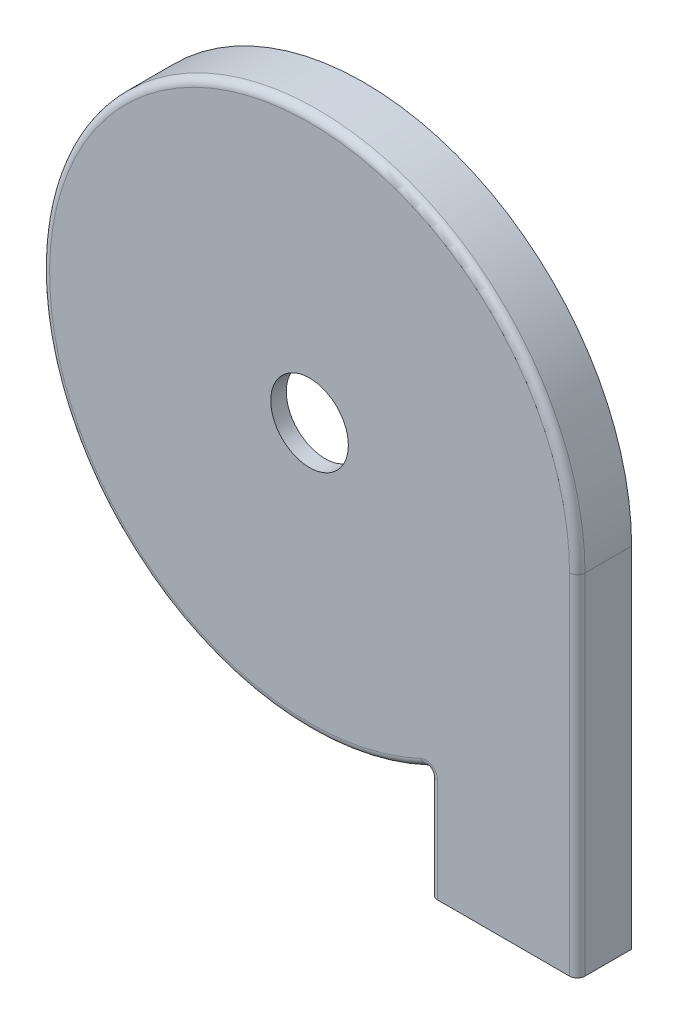
from build123d import *

# Parameters (mm, degrees)
BOSS_EXTRU_1_DEPTH      = 2
BOSS_EXTRU_2_START      = -7
BOSS_EXTRU_2_DEPTH      = 5
BOSS_EXTRU_3_START      = -1
BOSS_EXTRU_3_DEPTH      = 1
CONG_1_R                = 0.25
BOSS_EXTRU_4_DEPTH      = 2
CONG_4_R                = 1
ESQUISSE5_R             = 5
ENL_V_MAT_EXTRU_1_DEPTH = 55.929567647
ESQUISSE6_W             = 15
ESQUISSE6_H             = 5
ENL_V_MAT_EXTRU_2_DEPTH = 2
ENL_V_MAT_EXTRU_3_DEPTH = 2


with BuildPart() as part:
    # Esquisse1 → Boss.-Extru.1 (new body)
    with BuildSketch(Plane.XY):
        with BuildLine():
            Line((31.551874669, -39.37254902), (31.551874669, 5.62745098))
            ThreePointArc((31.551874669, 5.62745098), (-28.41563861, 22.999431705), (12.980446097, -23.736555864))
            ThreePointArc((12.980446097, -23.736555864), (15.388180878, -23.882439984), (16.551874669, -25.995325621))
            Line((16.551874669, -25.995325621), (16.551874669, -39.37254902))
            Line((16.551874669, -39.37254902), (31.551874669, -39.37254902))
        make_face()
    extrude(amount=BOSS_EXTRU_1_DEPTH)



with BuildPart() as body_2:
    # Esquisse2 → Boss.-Extru.2 (new body)
    with BuildSketch(Plane.XY.offset(2).offset(BOSS_EXTRU_2_START)):
        with BuildLine():
            Line((14.551874669, -41.37254902), (33.551874669, -41.37254902))
            Line((33.551874669, -41.37254902), (33.551874669, 5.62745098))
            ThreePointArc((33.551874669, 5.62745098), (-30.105947119, 24.068476672), (13.837588955, -25.54357167))
            ThreePointArc((13.837588955, -25.54357167), (14.319135911, -25.572748494), (14.551874669, -25.995325621))
            Line((14.551874669, -25.995325621), (14.551874669, -41.37254902))
        make_face()
        with BuildLine():
            Line((16.551874669, -39.37254902), (31.551874669, -39.37254902))
            Line((31.551874669, -39.37254902), (31.551874669, 5.62745098))
            ThreePointArc((31.551874669, 5.62745098), (-28.41563861, 22.999431705), (12.980446097, -23.736555864))
            ThreePointArc((12.980446097, -23.736555864), (15.388180878, -23.882439984), (16.551874669, -25.995325621))
            Line((16.551874669, -25.995325621), (16.551874669, -39.37254902))
        make_face(mode=Mode.SUBTRACT)
    extrude(amount=BOSS_EXTRU_2_DEPTH)

    # Esquisse3 → Boss.-Extru.3 (add)
    with BuildSketch(Plane(origin=(0, 0, -5), x_dir=(-1, 0, 0), z_dir=(0, 0, -1)).offset(BOSS_EXTRU_3_START)):
        with BuildLine():
            ThreePointArc((-12.980446097, -23.736555864), (28.41563861, 22.999431705), (-31.551874669, 5.62745098))
            Line((-31.551874669, 5.62745098), (-31.051874669, 5.62745098))
            ThreePointArc((-31.051874669, 5.62745098), (27.993061483, 22.732170463), (-12.766160383, -23.284801913))
            Line((-12.766160383, -23.284801913), (-12.980446097, -23.736555864))
        make_face()
    extrude(amount=-BOSS_EXTRU_3_DEPTH)

    # Congé1
    cong_1_edges = [body_2.edges().sort_by_distance(p)[0] for p in [
        (-27.993061483, 22.732170463, -4),
    ]]
    fillet(cong_1_edges, radius=CONG_1_R)


with BuildPart() as part_1:
    add(part.part)

    add(body_2.part)  # Boss.-Extru.4 merges body 2
    # Esquisse4 → Boss.-Extru.4 (add)
    with BuildSketch(Plane.XY):
        with BuildLine():
            Line((14.551874669, -25.995325621), (14.551874669, -41.37254902))
            Line((14.551874669, -41.37254902), (33.551874669, -41.37254902))
            Line((33.551874669, -41.37254902), (33.551874669, 5.62745098))
            ThreePointArc((33.551874669, 5.62745098), (-30.105947119, 24.068476672), (13.837588955, -25.54357167))
            ThreePointArc((13.837588955, -25.54357167), (14.319135911, -25.572748494), (14.551874669, -25.995325621))
        make_face()
    extrude(amount=BOSS_EXTRU_4_DEPTH)

    # Congé4
    cong_4_edges = [part_1.edges().sort_by_distance(p)[0] for p in [
        (14.319135911, -25.572748494, 2),
        (14.551874669, -33.68393732, 2),
        (33.551874669, -17.87254902, 2),
        (-30.105947119, 24.068476672, 2),
    ]]
    fillet(cong_4_edges, radius=CONG_4_R)

    # Esquisse5 → Enlèv. mat.-Extru.1 (cut, through all)
    with BuildSketch(Plane.XY.offset(2)):
        with Locations((-0.948125331, 5.62745098)):
            Circle(ESQUISSE5_R)
    extrude(amount=-ENL_V_MAT_EXTRU_1_DEPTH, mode=Mode.SUBTRACT)

    # Esquisse6 → Enlèv. mat.-Extru.2 (cut)
    with BuildSketch(Plane.XZ.offset(41.37254902)):
        with Locations((24.051874669, -2.5)):
            Rectangle(ESQUISSE6_W, ESQUISSE6_H)
    extrude(amount=-ENL_V_MAT_EXTRU_2_DEPTH, mode=Mode.SUBTRACT)

    # Esquisse7 → Enlèv. mat.-Extru.3 (cut)
    with BuildSketch(Plane.XZ.offset(41.37254902)):
        with BuildLine():
            Line((14.551874669, -5), (16.551874669, -5))
            Line((16.551874669, -5), (16.551874669, 0))
            Line((16.551874669, 0), (31.551874669, 0))
            Line((31.551874669, 0), (31.551874669, -5))
            Line((31.551874669, -5), (33.551874669, -5))
            Line((33.551874669, -5), (33.551874669, 1))
            ThreePointArc((33.551874669, 1), (33.25898145, 1.707106781), (32.551874669, 2))
            Line((32.551874669, 2), (15.551874669, 2))
            ThreePointArc((15.551874669, 2), (14.844767888, 1.707106781), (14.551874669, 1))
            Line((14.551874669, 1), (14.551874669, -5))
        make_face()
    extrude(amount=-ENL_V_MAT_EXTRU_3_DEPTH, mode=Mode.SUBTRACT)


solid = part_1.part
